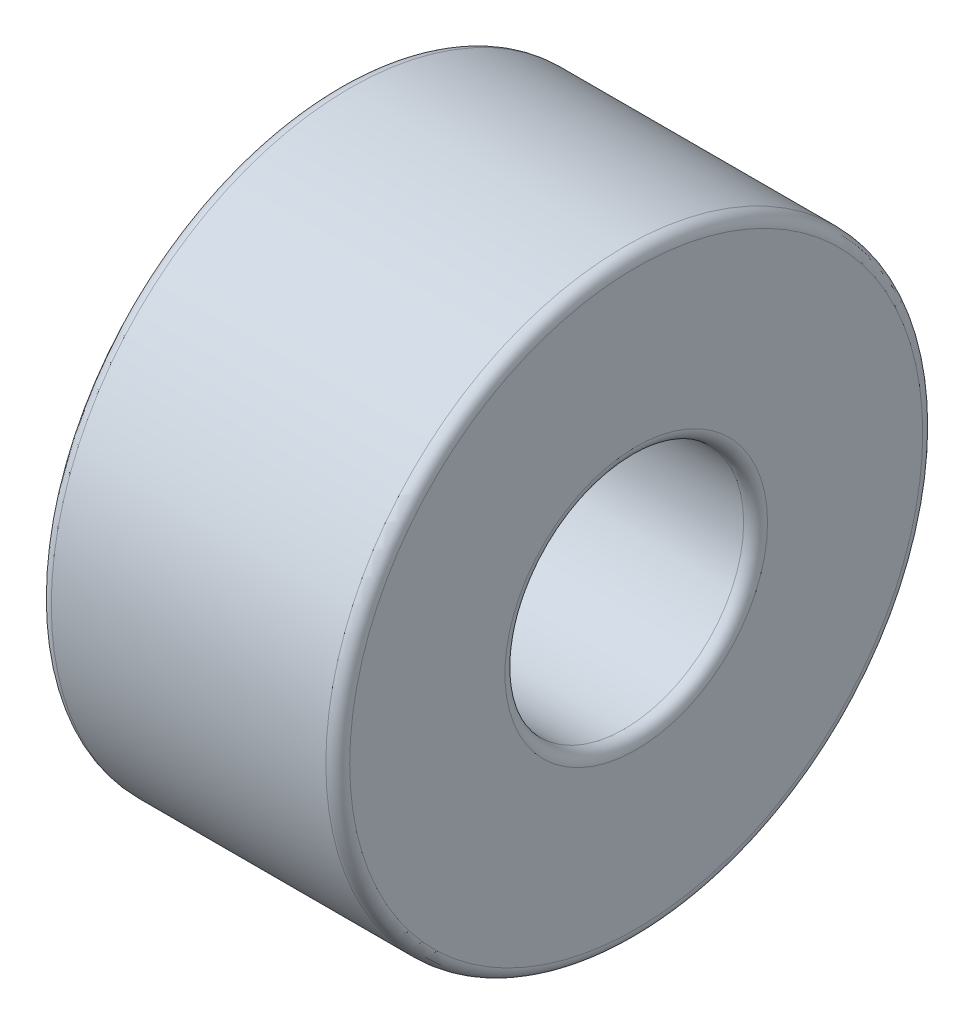
from build123d import *

# Parameters (mm, degrees)
SKETCH1_R           = 2.5
SKETCH1_R_2         = 1
BOSS_EXTRUDE1_DEPTH = 2.5
FILLET1_R           = 0.1
FILLET2_R           = 0.1
FILLET3_R           = 0.1
FILLET4_R           = 0.1


with BuildPart() as part:
    # Sketch1 → Boss-Extrude1 (new body)
    with BuildSketch(Plane(origin=(0, 0, 0), x_dir=(0, 0, -1), z_dir=(1, 0, 0))):
        Circle(SKETCH1_R)
        Circle(SKETCH1_R_2, mode=Mode.SUBTRACT)
    extrude(amount=BOSS_EXTRUDE1_DEPTH)

    # Fillet1
    fillet1_edges = [part.edges().sort_by_distance(p)[0] for p in [
        (2.5, 0, 2.5),
    ]]
    fillet(fillet1_edges, radius=FILLET1_R)

    # Fillet2
    fillet2_edges = [part.edges().sort_by_distance(p)[0] for p in [
        (2.5, 0, 1),
    ]]
    fillet(fillet2_edges, radius=FILLET2_R)

    # Fillet3
    fillet3_edges = [part.edges().sort_by_distance(p)[0] for p in [
        (0, 0, 2.5),
    ]]
    fillet(fillet3_edges, radius=FILLET3_R)

    # Fillet4
    fillet4_edges = [part.edges().sort_by_distance(p)[0] for p in [
        (0, 0, 1),
    ]]
    fillet(fillet4_edges, radius=FILLET4_R)


solid = part.part
